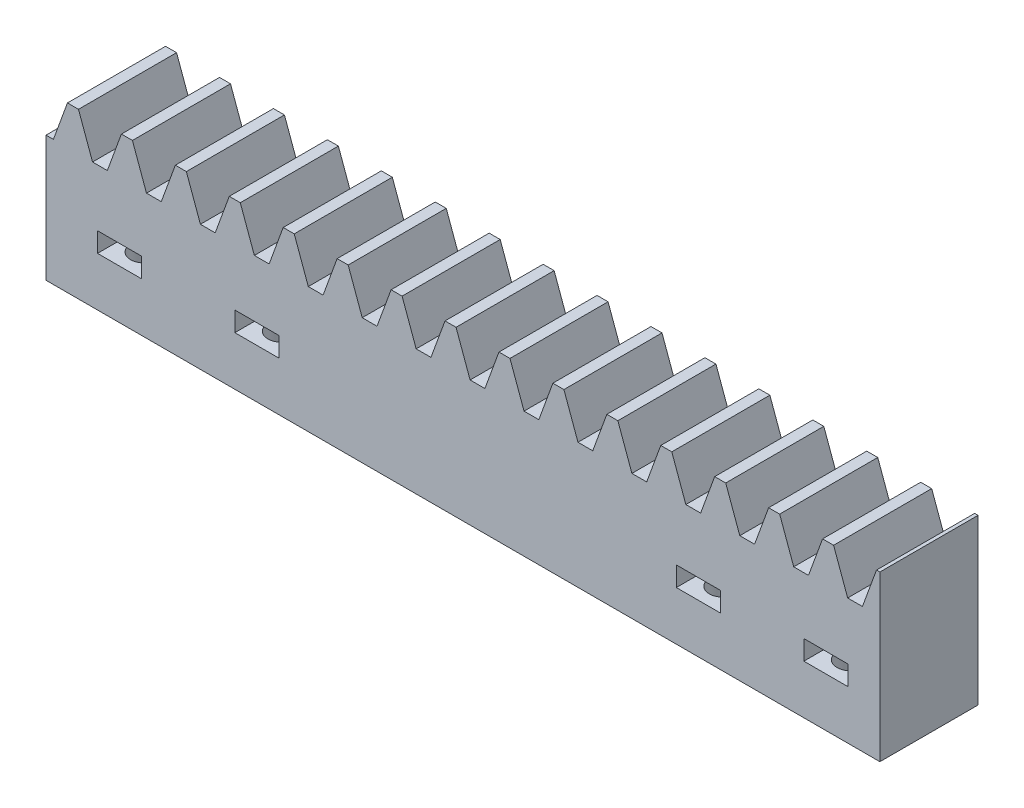
from build123d import *

# Parameters (mm, degrees)
BLANKSKE_W         = 170
BLANKSKE_H         = 33.5
BLANK_DEPTH        = 20
TOOTHCUTSIM_DEPTH  = 175.419752322
TEETHCUTS_COUNT    = 16
TEETHCUTS_PITCH    = 10.995574275
SKETCH2_W          = 9
SKETCH2_H          = 4
CUT_EXTRUDE1_DEPTH = 15
SKETCH4_R          = 2.75
CUT_EXTRUDE2_DEPTH = 20


with BuildPart() as part:
    # BlankSke → Blank (new body)
    with BuildSketch(Plane.XY):
        with Locations((85, 16.75)):
            Rectangle(BLANKSKE_W, BLANKSKE_H)
    extrude(amount=-BLANK_DEPTH)

    # TooCutSkeSim → ToothCutSim (cut, through all)
    with BuildSketch(Plane.XY):
        Polygon((1.507523794, 25.625), (-1.507523794, 25.625), (-4.383034233, 33.5254), (4.383034233, 33.5254), align=None)
    toothcutsim = extrude(amount=-TOOTHCUTSIM_DEPTH, mode=Mode.SUBTRACT)

    # TeethCuts: ToothCutSim ×16
    with Locations(*[(i * TEETHCUTS_PITCH, 0, 0) for i in range(1, TEETHCUTS_COUNT)]):
        add(toothcutsim, mode=Mode.SUBTRACT)

    # Sketch2 → Cut-Extrude1 (cut)
    with BuildSketch(Plane.XY):
        with Locations((15, 12)):
            Rectangle(SKETCH2_W, SKETCH2_H)
        with Locations((43, 12)):
            Rectangle(SKETCH2_W, SKETCH2_H)
        with Locations((133, 12)):
            Rectangle(SKETCH2_W, SKETCH2_H)
        with Locations((159, 12)):
            Rectangle(SKETCH2_W, SKETCH2_H)
    extrude(amount=-CUT_EXTRUDE1_DEPTH, mode=Mode.SUBTRACT)

    # Sketch4 → Cut-Extrude2 (cut)
    with BuildSketch(Plane.XZ):
        with Locations(Location((15, -5, 0), (0, 0, 270))):
            Circle(SKETCH4_R)
        with Locations(Location((43, -5, 0), (0, 0, 270))):
            Circle(SKETCH4_R)
        with Locations(Location((133, -5, 0), (0, 0, 270))):
            Circle(SKETCH4_R)
        with Locations(Location((159, -5, 0), (0, 0, 270))):
            Circle(SKETCH4_R)
    extrude(amount=-CUT_EXTRUDE2_DEPTH, mode=Mode.SUBTRACT)


solid = part.part
